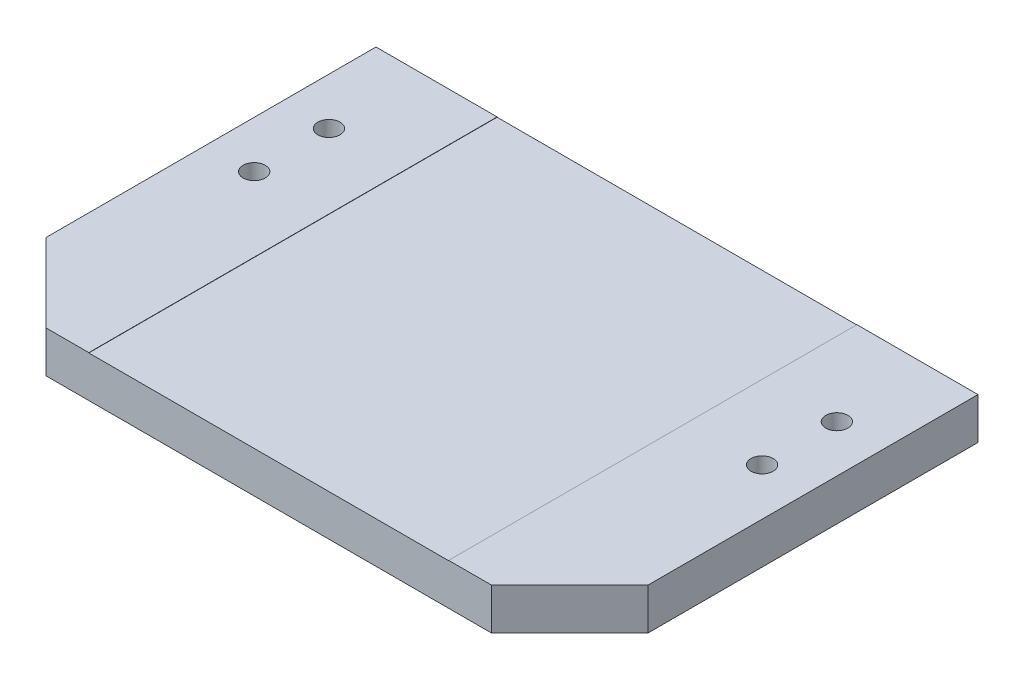
from build123d import *

# Parameters (mm, degrees)
ESQUISSE1_R             = 0.4
BOSS_EXTRU_1_DEPTH      = 1.5
ESQUISSE2_W             = 13
ESQUISSE2_H             = 14.75
ENL_V_MAT_EXTRU_1_DEPTH = 0.01


with BuildPart() as part:
    # Esquisse1 → Boss.-Extru.1 (new body)
    with BuildSketch(Plane(origin=(0, 0, 0), x_dir=(1, 0, 0), z_dir=(0, 1, 0))):
        Polygon((-10.875, 7.375), (10.875, 7.375), (10.875, -4.546572875), (8.046572875, -7.375), (-8.046572875, -7.375), (-10.875, -4.546572875), align=None)
        with Locations(Location((-9.175, 1.275, 0), (0, 0, 270))):
            Circle(ESQUISSE1_R, mode=Mode.SUBTRACT)
        with Locations(Location((-9.175, 3.975, 0), (0, 0, 270))):
            Circle(ESQUISSE1_R, mode=Mode.SUBTRACT)
        with Locations(Location((9.175, 1.275, 0), (0, 0, 270))):
            Circle(ESQUISSE1_R, mode=Mode.SUBTRACT)
        with Locations(Location((9.175, 3.975, 0), (0, 0, 270))):
            Circle(ESQUISSE1_R, mode=Mode.SUBTRACT)
    extrude(amount=BOSS_EXTRU_1_DEPTH)

    # Esquisse2 → Enlèv. mat.-Extru.1 (cut)
    with BuildSketch(Plane(origin=(0, 1.5, 0), x_dir=(1, 0, 0), z_dir=(0, 1, 0))):
        Rectangle(ESQUISSE2_W, ESQUISSE2_H)
    extrude(amount=-ENL_V_MAT_EXTRU_1_DEPTH, mode=Mode.SUBTRACT)


solid = part.part
